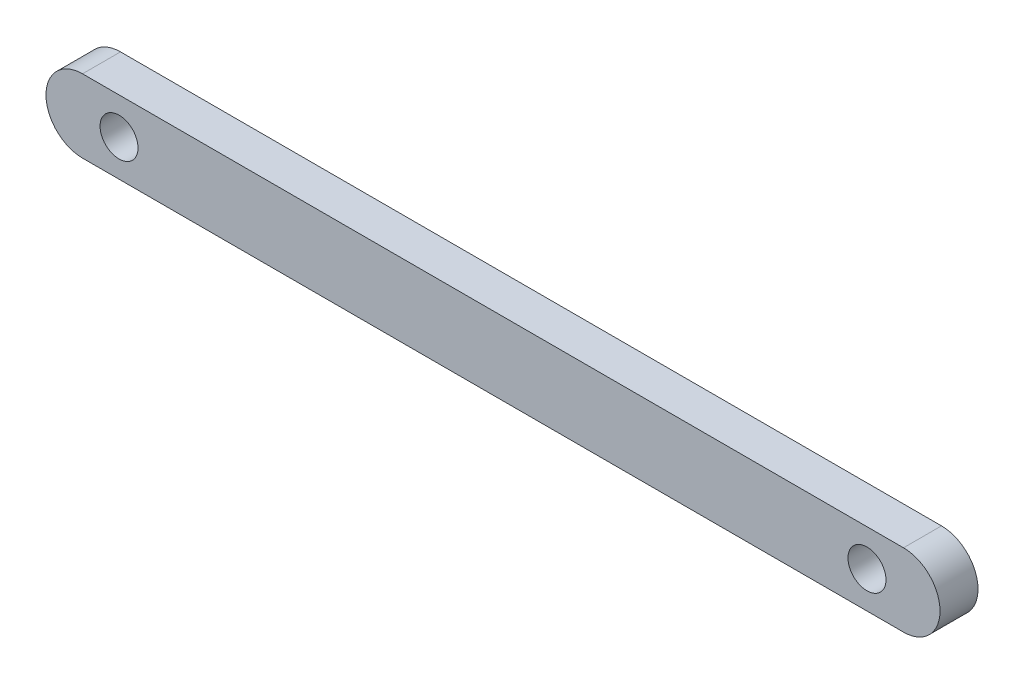
from build123d import *

# Parameters (mm, degrees)
BOSS_EXTRUDE1_DEPTH         = 3.302
F_3_8_0_13_DIAMETER_HOLE1_D = 3.302


with BuildPart() as part:
    # Sketch1 → Boss-Extrude1 (new body)
    with BuildSketch(Plane.XY):
        with BuildLine():
            Line((-35.687, 3.175), (35.687, 3.175))
            ThreePointArc((35.687, 3.175), (38.862, 0), (35.687, -3.175))
            Line((35.687, -3.175), (-35.687, -3.175))
            ThreePointArc((-35.687, -3.175), (-38.862, 0), (-35.687, 3.175))
        make_face()
    extrude(amount=BOSS_EXTRUDE1_DEPTH)

    # 3/8 (0.13) Diameter Hole1 (through all)
    with Locations(Plane.XY.offset(3.302)):
        with Locations((-32.512, 0), (32.512, 0)):
            Hole(F_3_8_0_13_DIAMETER_HOLE1_D / 2)


solid = part.part
